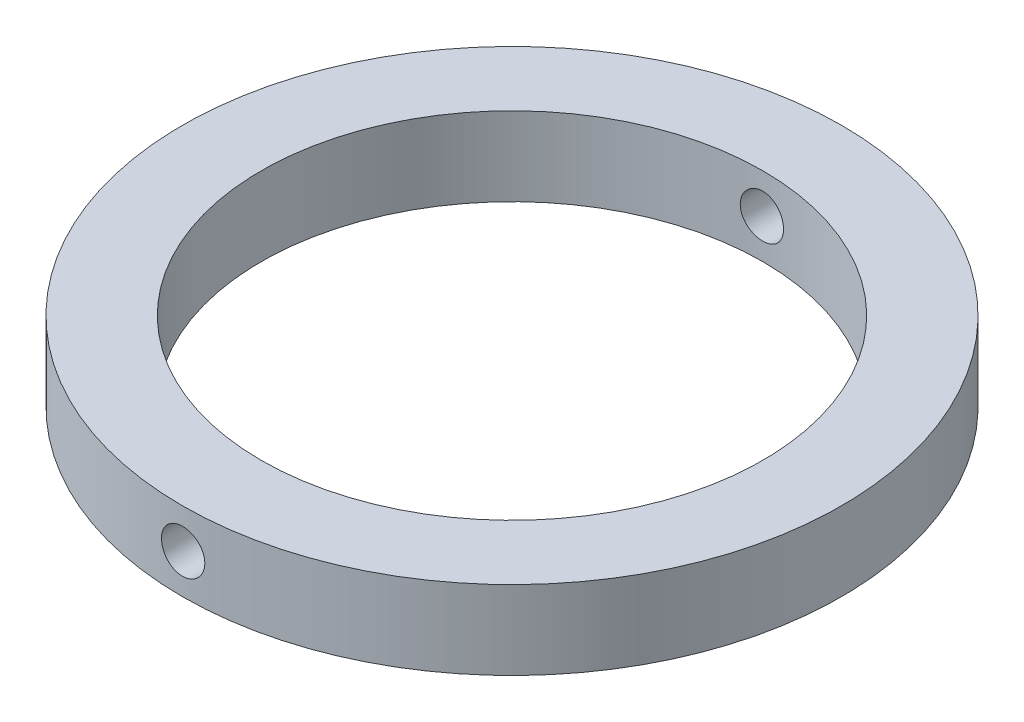
from build123d import *

# Parameters (mm, degrees)
SKETCH1_R               = 41.85
SKETCH1_R_2             = 31.85
BOSS_EXTRUDE1_DEPTH     = 10
CUT_EXTRUDE1_DEPTH      = 61.023703651
CUT_EXTRUDE1_DEPTH_BACK = 61.023703651
SKETCH5_R               = 2.75


with BuildPart() as part:
    # Sketch1 → Boss-Extrude1 (new body)
    with BuildSketch(Plane(origin=(0, 0, 0), x_dir=(1, 0, 0), z_dir=(0, 1, 0))):
        with Locations(Location((0, 0, 0), (0, 0, 270))):
            Circle(SKETCH1_R)
        with Locations(Location((0, 0, 0), (0, 0, 270))):
            Circle(SKETCH1_R_2, mode=Mode.SUBTRACT)
    extrude(amount=BOSS_EXTRUDE1_DEPTH)

    # Sketch5 → Cut-Extrude1 (cut, two sides: drawn at the far end of the back side and taken through both)
    with BuildSketch(Plane.XY.offset(-CUT_EXTRUDE1_DEPTH_BACK)):
        with Locations(Location((0, 5, 0), (0, 0, 270.000000033))):
            Circle(SKETCH5_R)
    extrude(amount=CUT_EXTRUDE1_DEPTH + CUT_EXTRUDE1_DEPTH_BACK, mode=Mode.SUBTRACT)


solid = part.part
